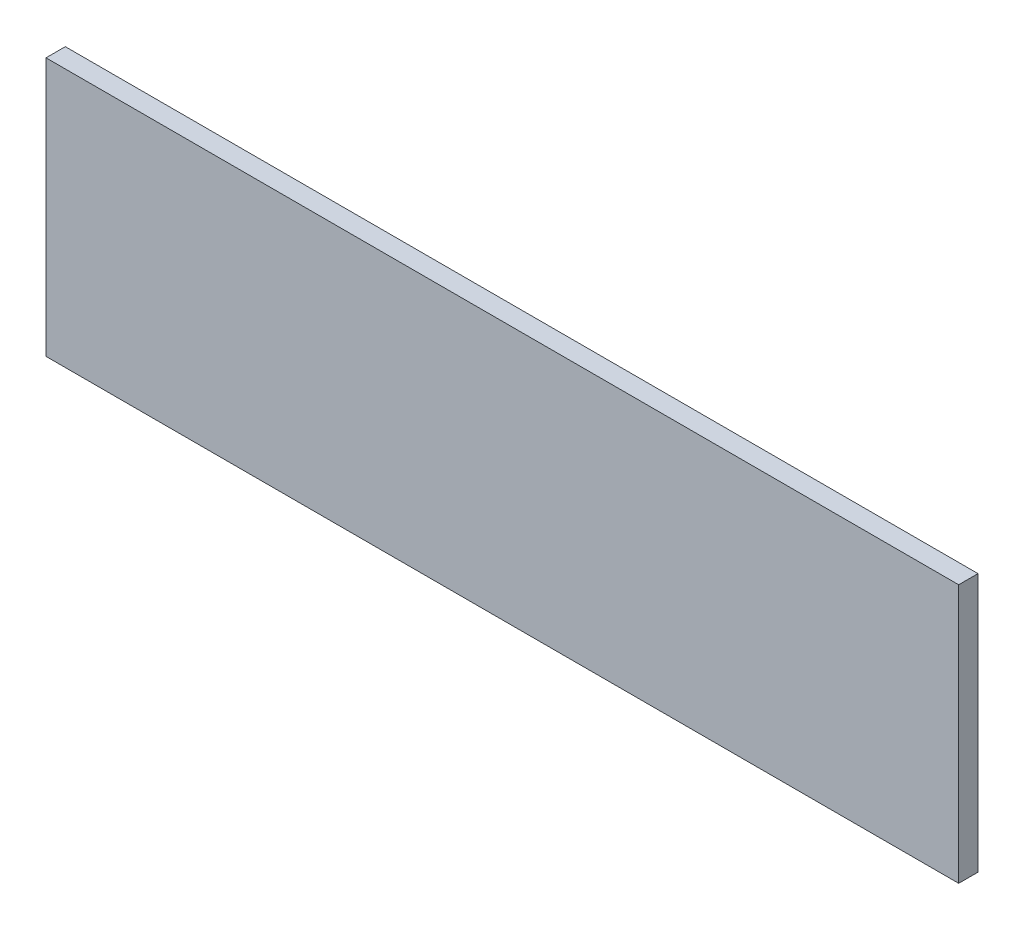
from build123d import *

# Parameters (mm, degrees)
CROQUIS1_W              = 600
CROQUIS1_H              = 170
SALIENTE_EXTRUIR1_DEPTH = 12.7


with BuildPart() as part:
    # Croquis1 → Saliente-Extruir1 (new body)
    with BuildSketch(Plane.XY):
        Rectangle(CROQUIS1_W, CROQUIS1_H)
    extrude(amount=SALIENTE_EXTRUIR1_DEPTH)


solid = part.part
